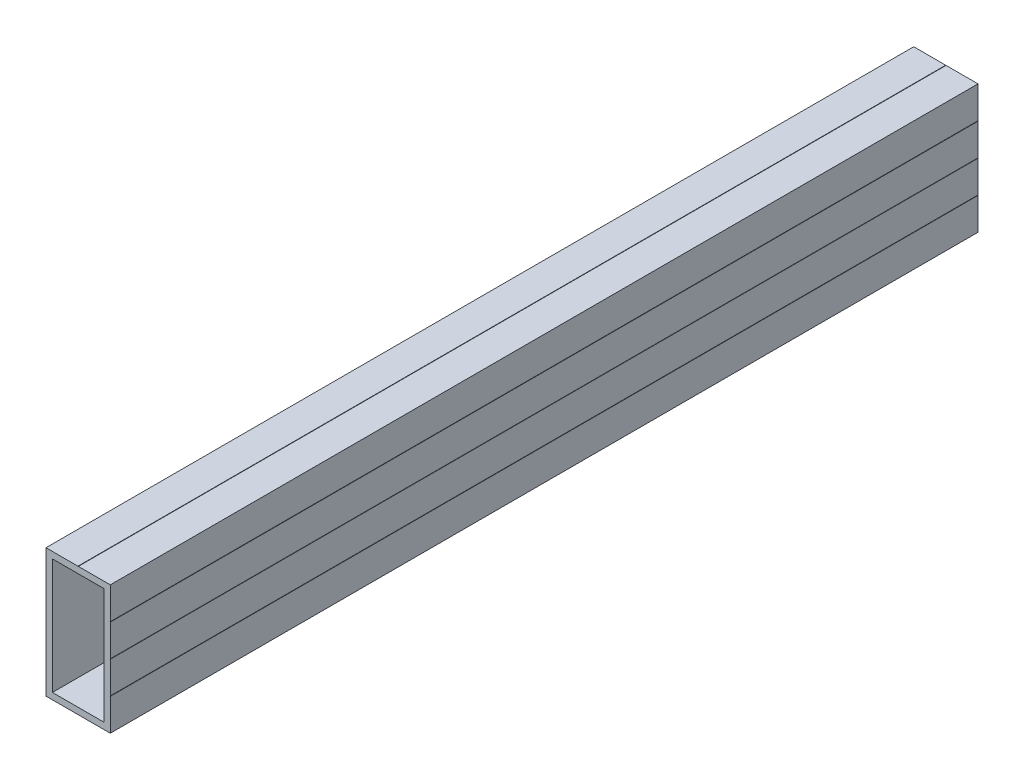
from build123d import *

# Parameters (mm, degrees)
SKETCH1_W           = 1498.6
SKETCH1_H           = 50.8
BOSS_EXTRUDE1_DEPTH = 25.4
CUT_EXTRUDE1_DEPTH  = 1498.6
CUT_EXTRUDE2_DEPTH  = 1499.869043646
CUT_EXTRUDE3_DEPTH  = 1498.6
CUT_EXTRUDE4_DEPTH  = 1498.6
CUT_EXTRUDE5_DEPTH  = 1499.869043646
CUT_EXTRUDE6_DEPTH  = 1499.869043646
CUT_EXTRUDE7_DEPTH  = 1498.6
CUT_EXTRUDE8_DEPTH  = 1498.6
SKETCH10_W          = 20.32
SKETCH10_H          = 45.72
CUT_EXTRUDE9_DEPTH  = 1499.869043646
DRAFT1_ANGLE        = 45
DRAFT2_ANGLE        = 45.000000005
DRAFT3_ANGLE        = 45
DRAFT4_ANGLE        = 45
DRAFT5_ANGLE        = 45
DRAFT6_ANGLE        = 44.999999995
SKETCH11_W          = 61.962293059
SKETCH11_H          = 88.678950317
CUT_EXTRUDE10_DEPTH = 1155.7


with BuildPart() as part:
    # Sketch1 → Boss-Extrude1 (new body)
    with BuildSketch(Plane(origin=(12.7, 0, 0), x_dir=(0, 0, -1), z_dir=(1, 0, 0))):
        Rectangle(SKETCH1_W, SKETCH1_H)
    extrude(amount=-BOSS_EXTRUDE1_DEPTH)

    # Sketch2 → Cut-Extrude1 (cut)
    with BuildSketch(Plane.XY.offset(749.3)):
        Polygon((0.0762, 25.4), (-0.0762, 25.4), (0.0762, 25.2476), align=None)
    extrude(amount=-CUT_EXTRUDE1_DEPTH, mode=Mode.SUBTRACT)

    # Sketch3 → Cut-Extrude2 (cut, through all)
    with BuildSketch(Plane.XY.offset(749.3)):
        Polygon((12.7, 12.6238), (12.7, 12.7762), (12.5476, 12.7762), align=None)
    extrude(amount=-CUT_EXTRUDE2_DEPTH, mode=Mode.SUBTRACT)

    # Sketch4 → Cut-Extrude3 (cut)
    with BuildSketch(Plane.XY.offset(749.3)):
        Polygon((12.7, -0.0762), (12.7, 0.0762), (12.5476, -0.0762), align=None)
    extrude(amount=-CUT_EXTRUDE3_DEPTH, mode=Mode.SUBTRACT)

    # Sketch5 → Cut-Extrude4 (cut)
    with BuildSketch(Plane.XY.offset(749.3)):
        Polygon((12.7, -12.7762), (12.7, -12.6238), (12.5476, -12.6238), align=None)
    extrude(amount=-CUT_EXTRUDE4_DEPTH, mode=Mode.SUBTRACT)

    # Sketch6 → Cut-Extrude5 (cut, through all)
    with BuildSketch(Plane.XY.offset(749.3)):
        Polygon((0.0762, -25.4), (-0.0762, -25.2476), (-0.0762, -25.4), align=None)
    extrude(amount=-CUT_EXTRUDE5_DEPTH, mode=Mode.SUBTRACT)

    # Sketch7 → Cut-Extrude6 (cut, through all)
    with BuildSketch(Plane.XY.offset(749.3)):
        Polygon((-12.7, -12.6238), (-12.7, -12.7762), (-12.5476, -12.7762), align=None)
    extrude(amount=-CUT_EXTRUDE6_DEPTH, mode=Mode.SUBTRACT)

    # Sketch8 → Cut-Extrude7 (cut)
    with BuildSketch(Plane.XY.offset(749.3)):
        Polygon((-12.7, 0.0762), (-12.7, -0.0762), (-12.5476, 0.0762), align=None)
    extrude(amount=-CUT_EXTRUDE7_DEPTH, mode=Mode.SUBTRACT)

    # Sketch9 → Cut-Extrude8 (cut)
    with BuildSketch(Plane.XY.offset(749.3)):
        Polygon((-12.7, 12.7762), (-12.7, 12.6238), (-12.5476, 12.6238), align=None)
    extrude(amount=-CUT_EXTRUDE8_DEPTH, mode=Mode.SUBTRACT)

    # Sketch10 → Cut-Extrude9 (cut, through all)
    with BuildSketch(Plane.XY.offset(749.3)):
        Rectangle(SKETCH10_W, SKETCH10_H)
    extrude(amount=-CUT_EXTRUDE9_DEPTH, mode=Mode.SUBTRACT)

    # Draft1
    draft1_faces = [part.faces().sort_by_distance(p)[0] for p in [
        (0.0762, 25.3238, 0),
    ]]
    draft(draft1_faces, Plane(origin=(-12.7, 25.4, -749.3), x_dir=(0, 0, 1), z_dir=(0, 1, 0)), DRAFT1_ANGLE)

    # Draft2
    draft2_faces = [part.faces().sort_by_distance(p)[0] for p in [
        (12.6238, 12.7762, 0),
    ]]
    draft(draft2_faces, Plane(origin=(12.7, 0, 0), x_dir=(0, 0, 1), z_dir=(1, 0, 0)), DRAFT2_ANGLE)

    # Draft3
    draft3_faces = [part.faces().sort_by_distance(p)[0] for p in [
        (-0.0762, -25.3238, 0),
    ]]
    draft(draft3_faces, Plane(origin=(-12.7, -25.4, 749.3), x_dir=(0, 0, -1), z_dir=(0, -1, 0)), DRAFT3_ANGLE)

    # Draft4
    draft4_faces = [part.faces().sort_by_distance(p)[0] for p in [
        (-12.6238, -12.7762, 0),
    ]]
    draft(draft4_faces, Plane(origin=(-12.7, 0, 0), x_dir=(0, 0, -1), z_dir=(-1, 0, 0)), DRAFT4_ANGLE)

    # Draft5
    draft5_faces = [part.faces().sort_by_distance(p)[0] for p in [
        (12.6238, -12.6238, 0),
        (12.6238, 0, 0),
    ]]
    draft(draft5_faces, Plane(origin=(12.7, 0, 0), x_dir=(0, 0, 1), z_dir=(1, 0, 0)), DRAFT5_ANGLE)

    # Draft6
    draft6_faces = [part.faces().sort_by_distance(p)[0] for p in [
        (-12.6238, 0, 0),
        (-12.6238, 12.6238, 0),
    ]]
    draft(draft6_faces, Plane(origin=(-12.7, 0, 0), x_dir=(0, 0, -1), z_dir=(-1, 0, 0)), DRAFT6_ANGLE)

    # Sketch11 → Cut-Extrude10 (cut)
    with BuildSketch(Plane(origin=(0, 0, -749.3), x_dir=(-1, 0, 0), z_dir=(0, 0, -1))):
        with Locations((-2.92473676, 0.325700182)):
            Rectangle(SKETCH11_W, SKETCH11_H)
    extrude(amount=-CUT_EXTRUDE10_DEPTH, mode=Mode.SUBTRACT)


solid = part.part
